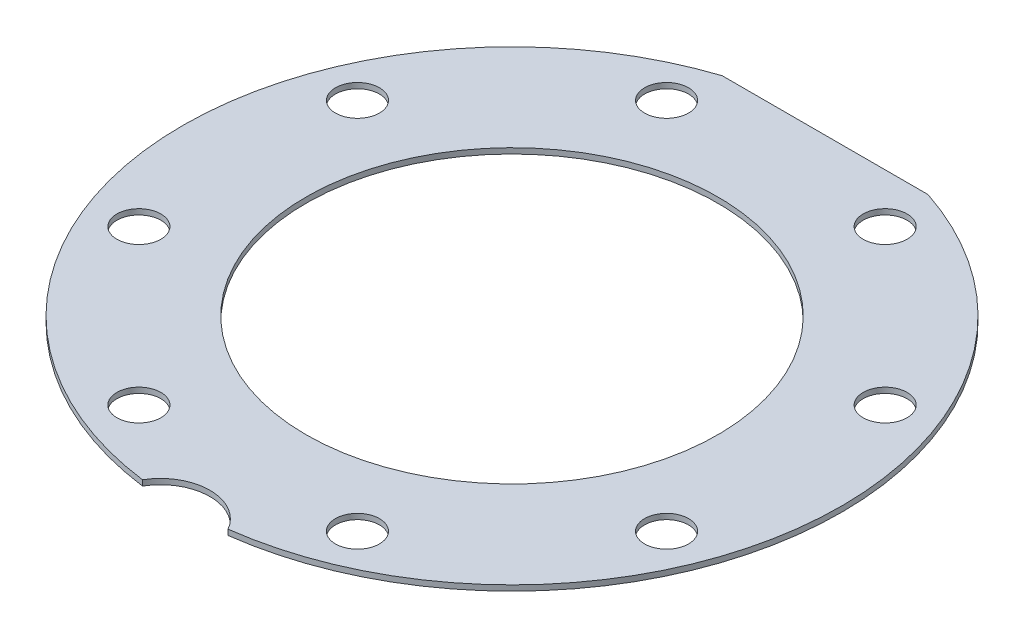
from build123d import *

# Parameters (mm, degrees)
SKETCH_1_R      = 37.5
SKETCH_1_R_2    = 4
EXTRUDE_1_DEPTH = 1


with BuildPart() as part:
    # 草图1 → 凸台-拉伸1 (new body)
    with BuildSketch(Plane(origin=(0, 0, 0), x_dir=(1, 0, 0), z_dir=(0, 1, 0))):
        with BuildLine():
            Line((18.734993995, 57), (-18.734993995, 57))
            ThreePointArc((-18.734993995, 57), (-59.736901958, -5.612712749), (-7.789712862, -59.4921875))
            ThreePointArc((-7.789712862, -59.4921875), (0, -55), (7.789712862, -59.4921875))
            ThreePointArc((7.789712862, -59.4921875), (59.736901958, -5.612712749), (18.734993995, 57))
        make_face()
        with Locations(Location((0, 0, 0), (0, 0, 270))):
            Circle(SKETCH_1_R, mode=Mode.SUBTRACT)
        with Locations(Location((-48.041735691, 19.899538483, 0), (0, 0, 270))):
            Circle(SKETCH_1_R_2, mode=Mode.SUBTRACT)
        with Locations(Location((-19.899538483, 48.041735691, 0), (0, 0, 270))):
            Circle(SKETCH_1_R_2, mode=Mode.SUBTRACT)
        with Locations(Location((19.899538483, 48.041735691, 0), (0, 0, 270))):
            Circle(SKETCH_1_R_2, mode=Mode.SUBTRACT)
        with Locations(Location((48.041735691, 19.899538483, 0), (0, 0, 270))):
            Circle(SKETCH_1_R_2, mode=Mode.SUBTRACT)
        with Locations(Location((48.041735691, -19.899538483, 0), (0, 0, 270))):
            Circle(SKETCH_1_R_2, mode=Mode.SUBTRACT)
        with Locations(Location((19.899538483, -48.041735691, 0), (0, 0, 270))):
            Circle(SKETCH_1_R_2, mode=Mode.SUBTRACT)
        with Locations(Location((-19.899538483, -48.041735691, 0), (0, 0, 270))):
            Circle(SKETCH_1_R_2, mode=Mode.SUBTRACT)
        with Locations(Location((-48.041735691, -19.899538483, 0), (0, 0, 270))):
            Circle(SKETCH_1_R_2, mode=Mode.SUBTRACT)
    extrude(amount=EXTRUDE_1_DEPTH)


solid = part.part
